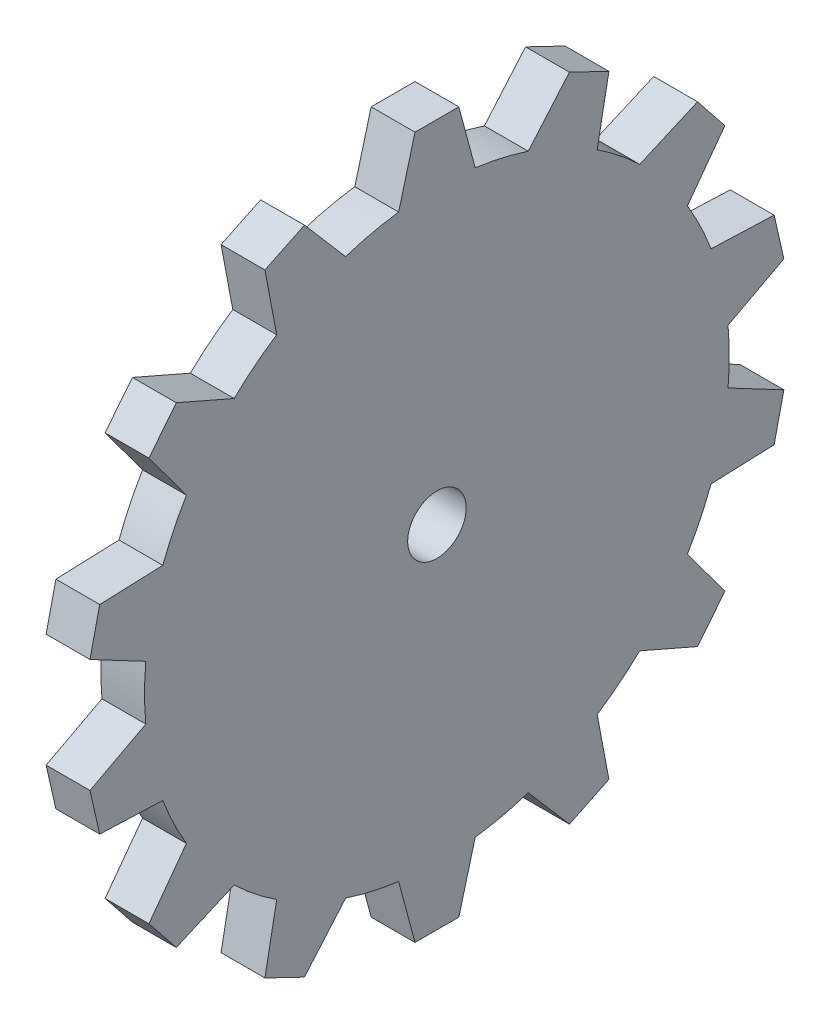
from build123d import *

# Parameters (mm, degrees)
SKETCH3_R                 = 20
BOSS_EXTRUDE2_DEPTH       = 3
BOSS_EXTRUDE3_DEPTH       = 3
CIRPATTERN1_COUNT         = 14
F_4_0MM_DOWEL_HOLE1_D     = 4
F_4_0MM_DOWEL_HOLE1_DEPTH = 3
F_4_0MM_DOWEL_HOLE1_TIP   = 1.201721238


with BuildPart() as part:
    # Sketch3 → Boss-Extrude2 (new body)
    with BuildSketch(Plane(origin=(0, 0, 0), x_dir=(0, 0, -1), z_dir=(1, 0, 0))):
        Circle(SKETCH3_R)
    extrude(amount=BOSS_EXTRUDE2_DEPTH)

    # Sketch4 → Boss-Extrude3 (add)
    with BuildSketch(Plane(origin=(3, 0, 0), x_dir=(0, 0, -1), z_dir=(1, 0, 0))):
        Polygon((1.5, 24.000314342), (2.617991667, 19.827912639), (-2.617991667, 19.827912639), (-1.5, 24.000314342), align=None)
    boss_extrude3 = extrude(amount=-BOSS_EXTRUDE3_DEPTH)

    # CirPattern1: Boss-Extrude3 ×14 about axis
    cirpattern1_axis = Axis((0, 0, 0), (1, 0, 0))
    for i in range(1, CIRPATTERN1_COUNT):
        add(boss_extrude3.rotate(cirpattern1_axis, i * 360 / CIRPATTERN1_COUNT))

    # Ø4.0mm Dowel Hole1
    with Locations(Plane(origin=(3, 0, 0), x_dir=(0, 0, -1), z_dir=(1, 0, 0))):
        with Locations((0, 0)):
            Hole(F_4_0MM_DOWEL_HOLE1_D / 2, depth=F_4_0MM_DOWEL_HOLE1_DEPTH)
            with Locations((0, 0, -(F_4_0MM_DOWEL_HOLE1_DEPTH + F_4_0MM_DOWEL_HOLE1_TIP / 2))):  # 118° drill point
                Cone(0, F_4_0MM_DOWEL_HOLE1_D / 2, F_4_0MM_DOWEL_HOLE1_TIP, mode=Mode.SUBTRACT)


solid = part.part
